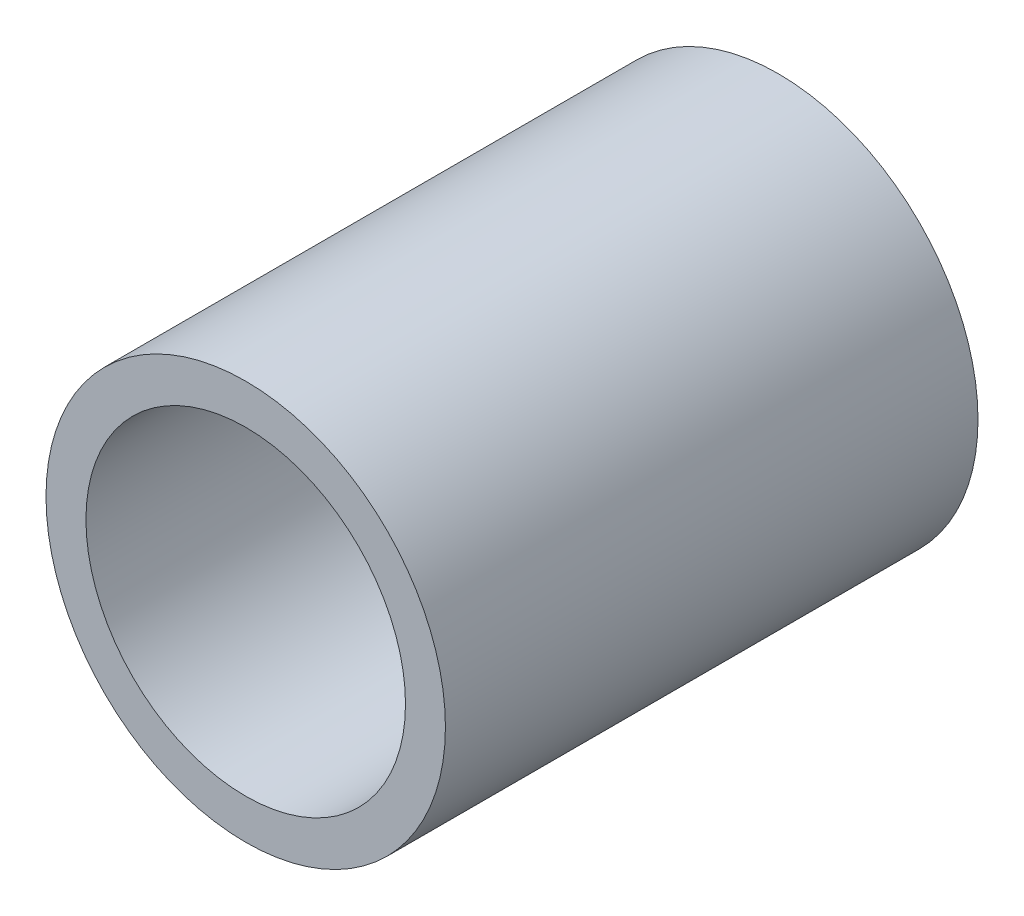
from build123d import *

# Parameters (mm, degrees)
SKETCH_1_R      = 7.5
SKETCH_1_R_2    = 6
EXTRUDE_1_DEPTH = 10


with BuildPart() as part:
    # 草图1 → 凸台-拉伸1 (new, symmetric)
    with BuildSketch(Plane.XY):
        Circle(SKETCH_1_R)
        Circle(SKETCH_1_R_2, mode=Mode.SUBTRACT)
    extrude(amount=EXTRUDE_1_DEPTH, both=True)


solid = part.part
